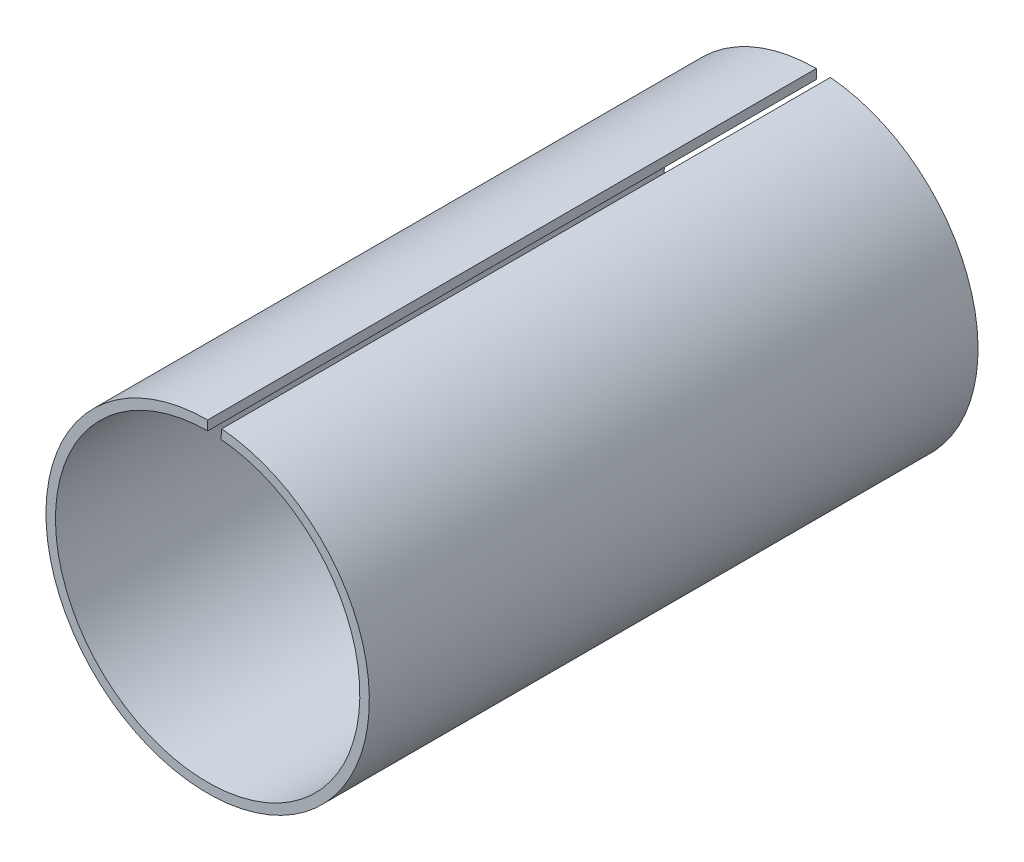
from build123d import *

# Parameters (mm, degrees)
SKETCH1_R           = 13.49375
SKETCH1_R_2         = 12.7
BOSS_EXTRUDE1_DEPTH = 50.8
CUT_EXTRUDE1_DEPTH  = 55.266035217


with BuildPart() as part:
    # Sketch1 → Boss-Extrude1 (new body)
    with BuildSketch(Plane.XY):
        Circle(SKETCH1_R)
        Circle(SKETCH1_R_2, mode=Mode.SUBTRACT)
    extrude(amount=BOSS_EXTRUDE1_DEPTH)

    # Sketch2 → Cut-Extrude1 (cut, through all)
    with BuildSketch(Plane.XY.offset(50.8)):
        with BuildLine():
            Line((0, 0), (0, 13.49375))
            ThreePointArc((0, 13.49375), (0.588589108, 13.48090694), (1.176057804, 13.442402207))
            Line((1.176057804, 13.442402207), (0, 0))
        make_face()
    extrude(amount=-CUT_EXTRUDE1_DEPTH, mode=Mode.SUBTRACT)


solid = part.part
